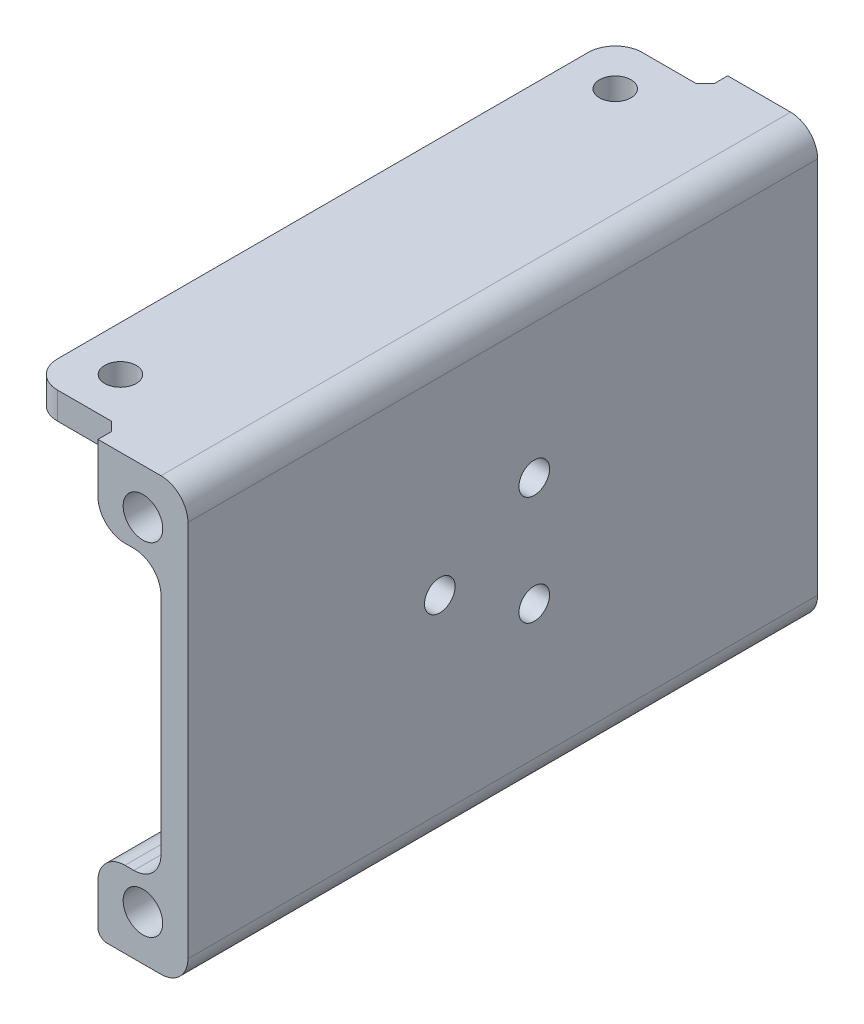
from build123d import *

# Parameters (mm, degrees)
BOSS_EXTRUDE1_DEPTH = 70
SKETCH2_R           = 2.2
CUT_EXTRUDE1_DEPTH  = 5.3
FILLET1_R           = 1
SKETCH4_R           = 1.7
CUT_EXTRUDE3_DEPTH  = 10
SKETCH5_R           = 1.75
BOSS_EXTRUDE2_DEPTH = 3
CHAMFER1_SIZE       = 1


with BuildPart() as part:
    # Sketch1 → Boss-Extrude1 (new body)
    with BuildSketch(Plane.XY):
        with BuildLine():
            Line((49, 24), (49, 18.5))
            ThreePointArc((49, 18.5), (49.878679656, 16.378679656), (52, 15.5))
            Line((52, 15.5), (53, 15.5))
            ThreePointArc((53, 15.5), (55.121320344, 14.621320344), (56, 12.5))
            Line((56, 12.5), (56, -12.5))
            ThreePointArc((56, -12.5), (55.121320344, -14.621320344), (53, -15.5))
            Line((53, -15.5), (52, -15.5))
            ThreePointArc((52, -15.5), (49.878679656, -16.378679656), (49, -18.5))
            Line((49, -18.5), (49, -24))
            Line((49, -24), (56, -24))
            ThreePointArc((56, -24), (58.121320344, -23.121320344), (59, -21))
            Line((59, -21), (59, 21))
            ThreePointArc((59, 21), (58.121320344, 23.121320344), (56, 24))
            Line((56, 24), (49, 24))
        make_face()
    extrude(amount=BOSS_EXTRUDE1_DEPTH)

    # Sketch2 → Cut-Extrude1 (cut)
    with BuildSketch(Plane(origin=(0, 0, 0), x_dir=(-1, 0, 0), z_dir=(0, 0, -1))):
        with Locations((-54, -19)):
            Circle(SKETCH2_R)
        with Locations((-54, 19)):
            Circle(SKETCH2_R)
    cut_extrude1 = extrude(amount=-CUT_EXTRUDE1_DEPTH, mode=Mode.SUBTRACT)

    # Mirror1: Cut-Extrude1 across plane
    add(cut_extrude1.mirror(Plane(origin=(0, 0, 35), x_dir=(1, 0, 0), z_dir=(0, 0, -1))), mode=Mode.SUBTRACT)

    # Fillet1
    fillet1_edges = [part.edges().sort_by_distance(p)[0] for p in [
        (49, -24, 35),
    ]]
    fillet(fillet1_edges, radius=FILLET1_R)

    # Sketch4 → Cut-Extrude3 (cut)
    with BuildSketch(Plane(origin=(59, 0, 0), x_dir=(0, 0, -1), z_dir=(1, 0, 0))):
        with Locations(Location((-42, 0, 0), (0, 0, 90))):
            Circle(SKETCH4_R)
        with Locations(Location((-31.5, 6.062177826, 0), (0, 0, 90))):
            Circle(SKETCH4_R)
        with Locations(Location((-31.5, -6.062177826, 0), (0, 0, 90))):
            Circle(SKETCH4_R)
    extrude(amount=-CUT_EXTRUDE3_DEPTH, mode=Mode.SUBTRACT)

    # Sketch5 → Boss-Extrude2 (add)
    with BuildSketch(Plane.XZ.offset(-24)):
        with BuildLine():
            Line((49, 2.5), (42, 2.5))
            ThreePointArc((42, 2.5), (39.878679656, 3.378679656), (39, 5.5))
            Line((39, 5.5), (39, 64.5))
            ThreePointArc((39, 64.5), (39.878679656, 66.621320344), (42, 67.5))
            Line((42, 67.5), (49, 67.5))
            Line((49, 67.5), (49, 2.5))
        make_face()
        with Locations(Location((44, 62.5, 0), (0, 0, 270))):
            Circle(SKETCH5_R, mode=Mode.SUBTRACT)
        with Locations(Location((44, 7.5, 0), (0, 0, 90))):
            Circle(SKETCH5_R, mode=Mode.SUBTRACT)
    extrude(amount=BOSS_EXTRUDE2_DEPTH)

    # Chamfer1
    chamfer1_edges = [part.edges().sort_by_distance(p)[0] for p in [
        (49, 21, 35),
        (49, 22.5, 2.5),
        (49, 22.5, 67.5),
    ]]
    chamfer(chamfer1_edges, length=CHAMFER1_SIZE)


solid = part.part
